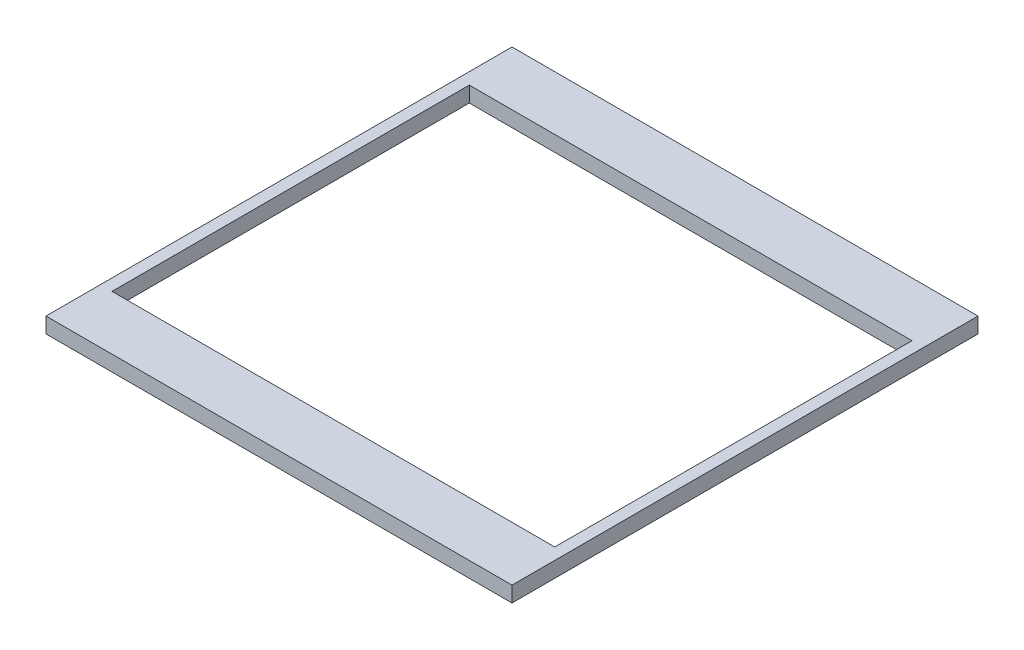
from build123d import *

# Parameters (mm, degrees)
SKETCH1_W               = 76.2
SKETCH1_H               = 76.2
BODY_DEPTH              = 2.54
SKETCH2_W               = 72.39
SKETCH2_H               = 58.42
CIRCUITBOARD_HOLE_DEPTH = 2.54


with BuildPart() as part:
    # Sketch1 → body (new body)
    with BuildSketch(Plane(origin=(0, 0, 0), x_dir=(1, 0, 0), z_dir=(0, 1, 0))):
        Rectangle(SKETCH1_W, SKETCH1_H)
    extrude(amount=BODY_DEPTH)

    # Sketch2 → circuitboard hole (cut)
    with BuildSketch(Plane(origin=(0, 2.54, 0), x_dir=(1, 0, 0), z_dir=(0, 1, 0))):
        Rectangle(SKETCH2_W, SKETCH2_H)
    extrude(amount=-CIRCUITBOARD_HOLE_DEPTH, mode=Mode.SUBTRACT)


solid = part.part
